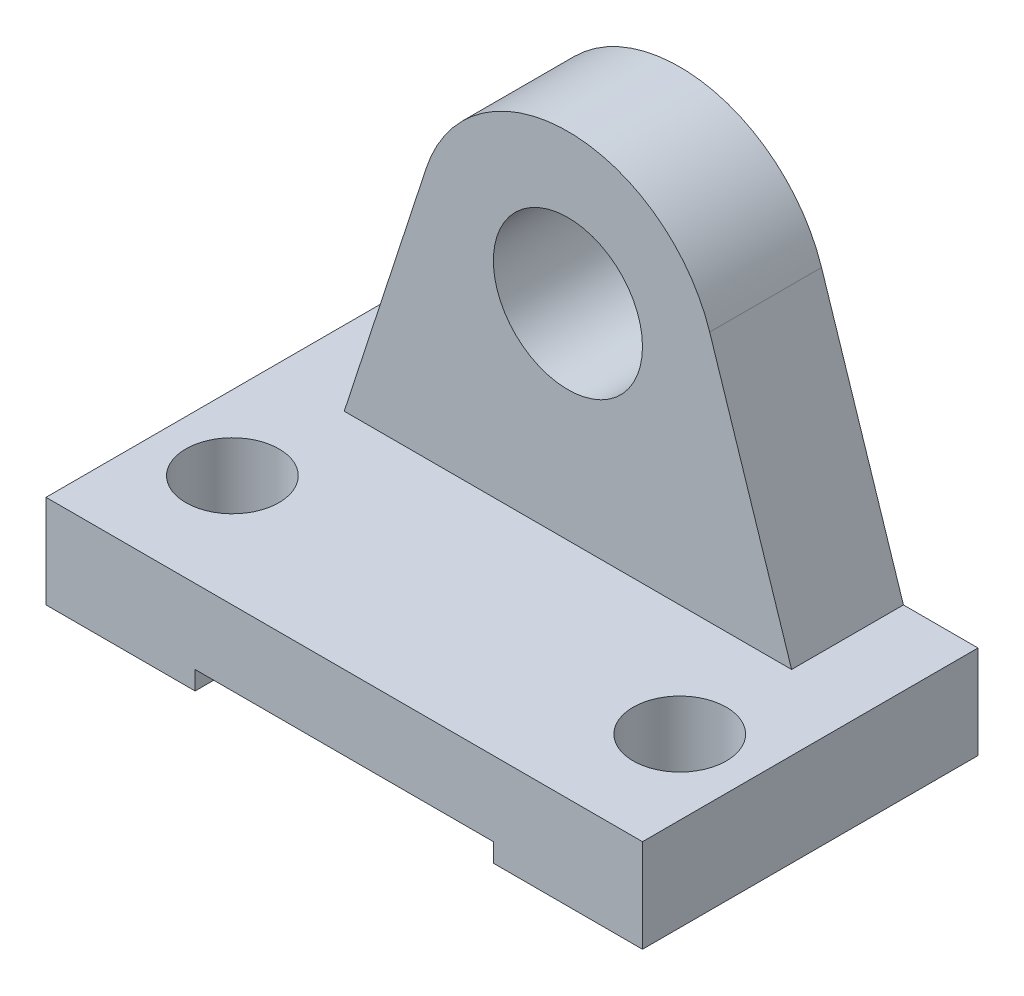
from build123d import *

# Parameters (mm, degrees)
EXTRUDE_2_DEPTH     = 18
SKETCH_1_4_R        = 4
EXTRUDE_3_DEPTH     = 6
SKETCH_3_R          = 2.5
CUT_EXTRUDE_2_DEPTH = 31.6757233


with BuildPart() as part:
    # 草图1 → 凸台-拉伸2 (new body)
    with BuildSketch(Plane.XY):
        Polygon((8, 0), (-8, 0), (-8, -1), (-16, -1), (-16, 4), (16, 4), (16, -1), (8, -1), align=None)
    extrude(amount=EXTRUDE_2_DEPTH)

    # 草图1<4> → 凸台-拉伸3 (add)
    with BuildSketch(Plane.XY):
        with BuildLine():
            Line((-12, 4), (12, 4))
            Line((12, 4), (7.606095567, 17.479376982))
            ThreePointArc((7.606095567, 17.479376982), (0, 23), (-7.606095567, 17.479376982))
            Line((-7.606095567, 17.479376982), (-12, 4))
        make_face()
        with Locations((0, 15)):
            Circle(SKETCH_1_4_R, mode=Mode.SUBTRACT)
    extrude(amount=EXTRUDE_3_DEPTH)

    # 草图3 → 切除-拉伸2 (cut, through all)
    with BuildSketch(Plane(origin=(0, 4, 0), x_dir=(1, 0, 0), z_dir=(0, 1, 0))):
        with Locations((-12, -12)):
            Circle(SKETCH_3_R)
        with Locations((12, -12)):
            Circle(SKETCH_3_R)
    extrude(amount=-CUT_EXTRUDE_2_DEPTH, mode=Mode.SUBTRACT)


solid = part.part
